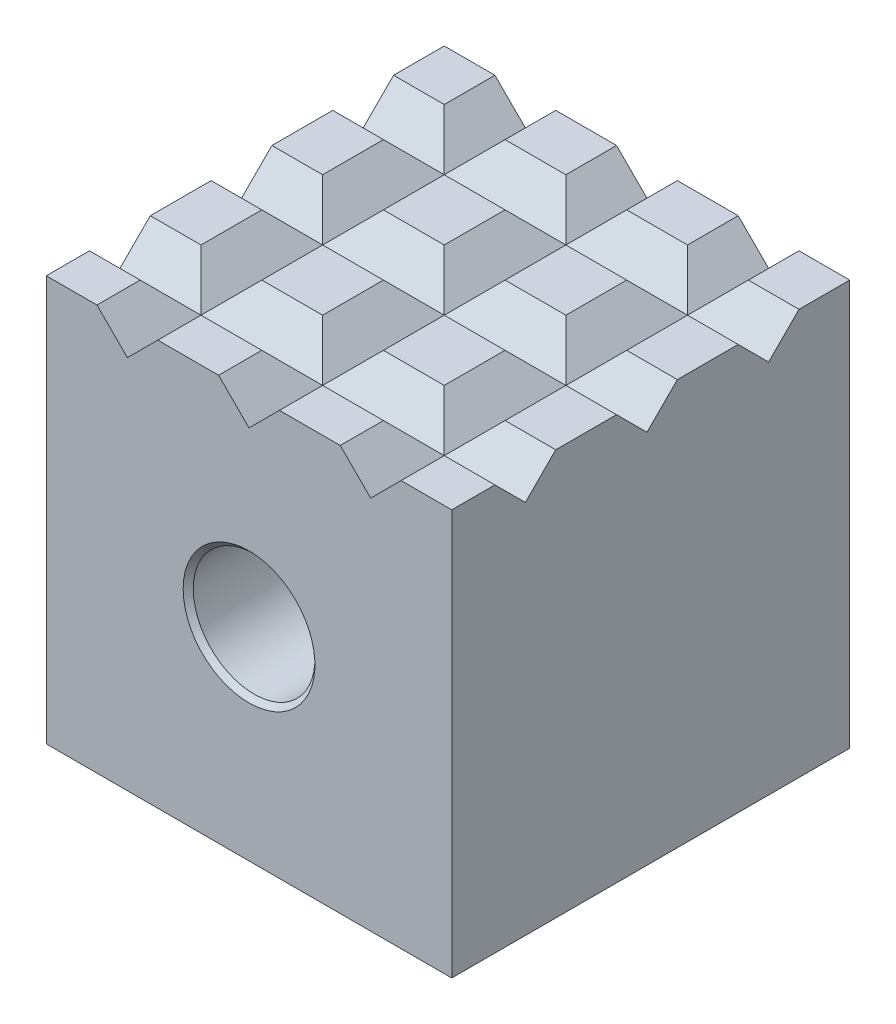
from build123d import *

# Parameters (mm, degrees)
SKETCH1_W           = 20
SKETCH1_H           = 20
SKETCH1_R           = 3
BOSS_EXTRUDE1_DEPTH = 19.63
CUT_EXTRUDE1_DEPTH  = 26
CUT_EXTRUDE2_DEPTH  = 26
CHAMFER1_SIZE       = 0.25
CHAMFER2_SIZE       = 0.25


with BuildPart() as part:
    # Sketch1 → Boss-Extrude1 (new body)
    with BuildSketch(Plane.XY):
        Rectangle(SKETCH1_W, SKETCH1_H)
        Circle(SKETCH1_R, mode=Mode.SUBTRACT)
    extrude(amount=BOSS_EXTRUDE1_DEPTH)

    # Sketch2 → Cut-Extrude1 (cut)
    with BuildSketch(Plane(origin=(0, 0, 0), x_dir=(-1, 0, 0), z_dir=(0, 0, -1))):
        Polygon((-6, 8.5), (-4.5, 10), (-7.5, 10), align=None)
        Polygon((-1.5, 10), (0, 8.5), (1.5, 10), align=None)
        Polygon((7.5, 10), (4.5, 10), (6, 8.5), align=None)
    extrude(amount=-CUT_EXTRUDE1_DEPTH, mode=Mode.SUBTRACT)

    # Sketch3 → Cut-Extrude2 (cut)
    with BuildSketch(Plane(origin=(-10, 0, 10), x_dir=(0, 0, -1), z_dir=(1, 0, 0))):
        Polygon((7.5, 10), (4.5, 10), (6, 8.5), align=None)
        Polygon((-1.5, 10), (0, 8.5), (1.5, 10), align=None)
        Polygon((-6, 8.5), (-4.5, 10), (-7.5, 10), align=None)
    extrude(amount=CUT_EXTRUDE2_DEPTH, mode=Mode.SUBTRACT)

    # Chamfer1
    chamfer1_edges = [part.edges().sort_by_distance(p)[0] for p in [
        (-3, 0, 0),
    ]]
    chamfer(chamfer1_edges, length=CHAMFER1_SIZE)

    # Chamfer2
    chamfer2_edges = [part.edges().sort_by_distance(p)[0] for p in [
        (-3, 0, 19.63),
    ]]
    chamfer(chamfer2_edges, length=CHAMFER2_SIZE)


solid = part.part
